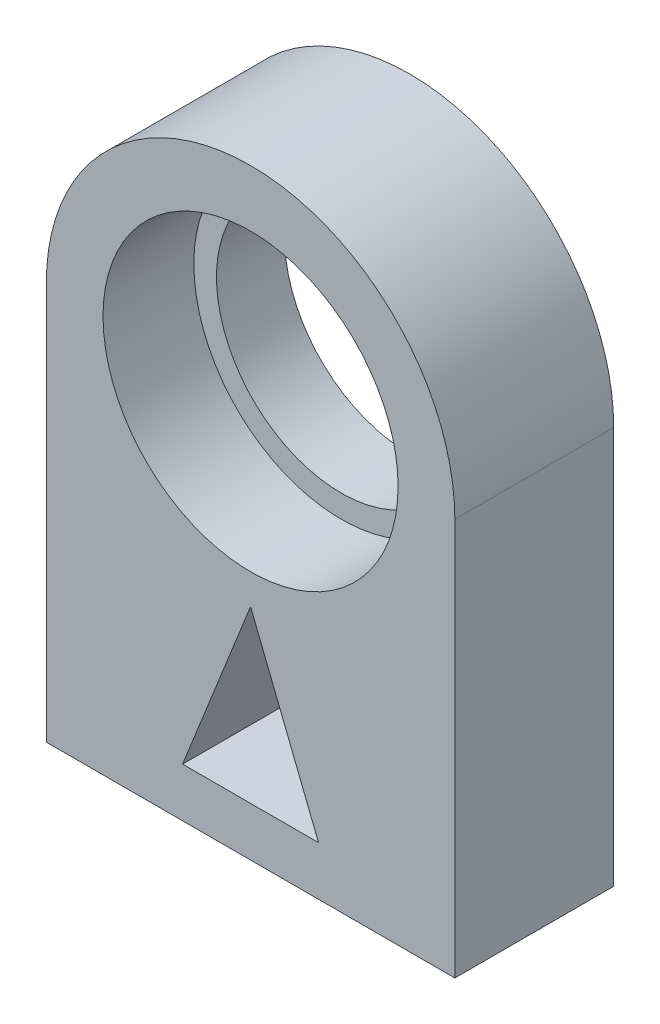
from build123d import *

# Parameters (mm, degrees)
BOSS_EXTRUDE1_DEPTH = 7
SKETCH2_R           = 1.25
CUT_EXTRUDE1_DEPTH  = 12
SKETCH3_R           = 6.5
CUT_EXTRUDE2_DEPTH  = 4
SKETCH4_W           = 18
SKETCH4_H           = 7
CUT_EXTRUDE3_DEPTH  = 0.5
CUT_EXTRUDE5_DEPTH  = 10


with BuildPart() as part:
    # Sketch1 → Boss-Extrude1 (new body)
    with BuildSketch(Plane.XY):
        with BuildLine():
            ThreePointArc((18, 18), (9, 27), (0, 18))
            Line((0, 18), (3.5, 18))
            ThreePointArc((3.5, 18), (9, 23.5), (14.5, 18))
            Line((14.5, 18), (18, 18))
        make_face()
        with BuildLine():
            Line((3.5, 18), (0, 18))
            ThreePointArc((0, 18), (9, 9), (18, 18))
            Line((18, 18), (14.5, 18))
            ThreePointArc((14.5, 18), (9, 12.5), (3.5, 18))
        make_face()
        with BuildLine():
            Line((0, 18), (0, 0))
            Line((0, 0), (18, 0))
            Line((18, 0), (18, 18))
            ThreePointArc((18, 18), (9, 9), (0, 18))
        make_face()
    extrude(amount=BOSS_EXTRUDE1_DEPTH)

    # Sketch2 → Cut-Extrude1 (cut)
    with BuildSketch(Plane.XZ):
        with Locations(Location((15, 3.5, 0), (0, 0, 270))):
            Circle(SKETCH2_R)
        with Locations(Location((3, 3.5, 0), (0, 0, 270))):
            Circle(SKETCH2_R)
    extrude(amount=-CUT_EXTRUDE1_DEPTH, mode=Mode.SUBTRACT)

    # Sketch3 → Cut-Extrude2 (cut)
    with BuildSketch(Plane.XY.offset(7)):
        with Locations((9, 18)):
            Circle(SKETCH3_R)
    extrude(amount=-CUT_EXTRUDE2_DEPTH, mode=Mode.SUBTRACT)

    # Sketch4 → Cut-Extrude3 (cut)
    with BuildSketch(Plane.XZ):
        with Locations((9, 3.5)):
            Rectangle(SKETCH4_W, SKETCH4_H)
    extrude(amount=-CUT_EXTRUDE3_DEPTH, mode=Mode.SUBTRACT)

    # Sketch5 → Cut-Extrude5 (cut)
    with BuildSketch(Plane(origin=(0, 0, 0), x_dir=(-1, 0, 0), z_dir=(0, 0, -1))):
        Polygon((-9, 10.170210674), (-6.004587273, 2.662945465), (-11.995412727, 2.662945465), align=None)
    extrude(amount=-CUT_EXTRUDE5_DEPTH, mode=Mode.SUBTRACT)


solid = part.part
